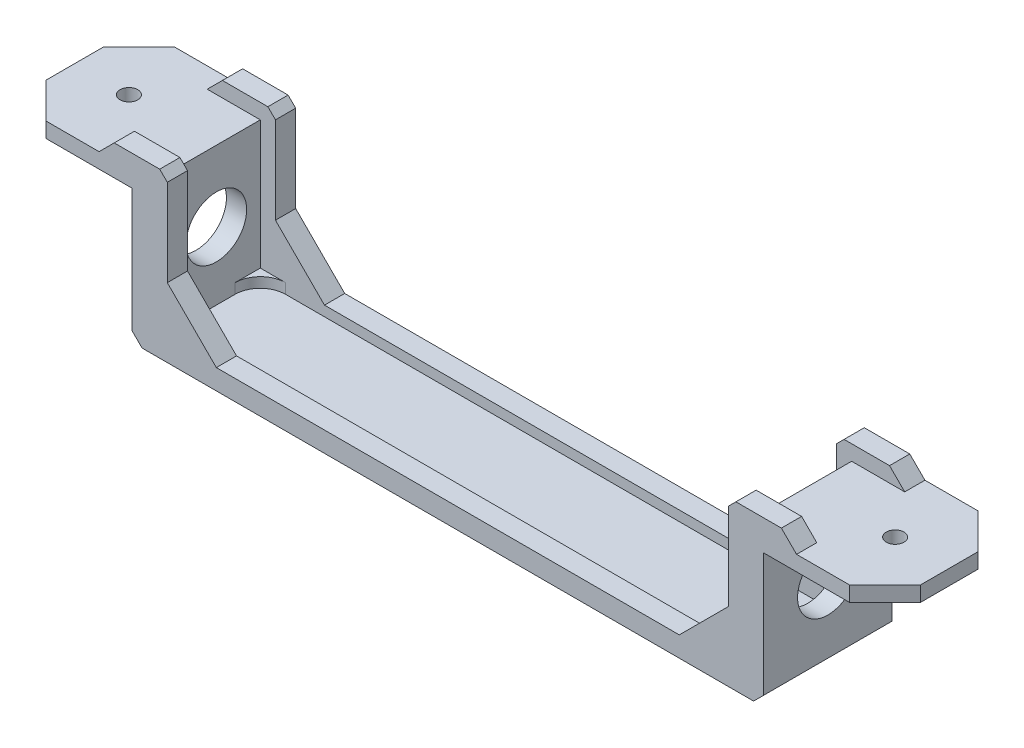
from build123d import *

# Parameters (mm, degrees)
SKETCH1_W           = 125
SKETCH1_H           = 25.4
BOSS_EXTRUDE1_DEPTH = 4
SKETCH2_W           = 117
SKETCH2_H           = 17.4
CUT_EXTRUDE1_DEPTH  = 2
FILLET1_R           = 5
SKETCH3_W           = 4
SKETCH3_H           = 25.4
BOSS_EXTRUDE2_DEPTH = 25.4
CHAMFER1_SIZE       = 2
SKETCH4_R           = 6
CUT_EXTRUDE3_DEPTH  = 135.4
SKETCH5_W           = 25.4
SKETCH5_H           = 3
BOSS_EXTRUDE3_DEPTH = 24
SKETCH6_W           = 25.4
SKETCH6_H           = 3
BOSS_EXTRUDE4_DEPTH = 24
BOSS_EXTRUDE5_DEPTH = 4
BOSS_EXTRUDE6_DEPTH = 4
SKETCH9_R           = 1.75
CUT_EXTRUDE4_DEPTH  = 4
CHAMFER2_SIZE       = 7
BOSS_EXTRUDE7_DEPTH = 4
BOSS_EXTRUDE8_DEPTH = 4
CHAMFER3_SIZE       = 1.5


with BuildPart() as part:
    # Sketch1 → Boss-Extrude1 (new body)
    with BuildSketch(Plane(origin=(0, 0, 0), x_dir=(1, 0, 0), z_dir=(0, 1, 0))):
        Rectangle(SKETCH1_W, SKETCH1_H)
    extrude(amount=BOSS_EXTRUDE1_DEPTH)

    # Sketch2 → Cut-Extrude1 (cut)
    with BuildSketch(Plane(origin=(0, 4, 0), x_dir=(1, 0, 0), z_dir=(0, 1, 0))):
        Rectangle(SKETCH2_W, SKETCH2_H)
    extrude(amount=-CUT_EXTRUDE1_DEPTH, mode=Mode.SUBTRACT)

    # Fillet1
    fillet1_edges = [part.edges().sort_by_distance(p)[0] for p in [
        (58.5, 3, -8.7),
        (58.5, 3, 8.7),
        (-58.5, 3, 8.7),
        (-58.5, 3, -8.7),
    ]]
    fillet(fillet1_edges, radius=FILLET1_R)

    # Sketch3 → Boss-Extrude2 (add)
    with BuildSketch(Plane(origin=(0, 4, 0), x_dir=(1, 0, 0), z_dir=(0, 1, 0))):
        with Locations((60.5, 0)):
            Rectangle(SKETCH3_W, SKETCH3_H)
        with Locations((-60.5, 0)):
            Rectangle(SKETCH3_W, SKETCH3_H)
    extrude(amount=BOSS_EXTRUDE2_DEPTH)

    # Chamfer1
    chamfer1_edges = [part.edges().sort_by_distance(p)[0] for p in [
        (-62.5, 0, 0),
        (62.5, 0, 0),
    ]]
    chamfer(chamfer1_edges, length=CHAMFER1_SIZE)

    # Sketch4 → Cut-Extrude3 (cut)
    with BuildSketch(Plane(origin=(62.5, 0, 0), x_dir=(0, 0, -1), z_dir=(1, 0, 0))):
        with Locations((0, 15.4)):
            Circle(SKETCH4_R)
    extrude(amount=-CUT_EXTRUDE3_DEPTH, mode=Mode.SUBTRACT)

    # Sketch5 → Boss-Extrude3 (add)
    with BuildSketch(Plane.ZY.offset(62.5)):
        with Locations((0, 27.9)):
            Rectangle(SKETCH5_W, SKETCH5_H)
    extrude(amount=BOSS_EXTRUDE3_DEPTH)

    # Sketch6 → Boss-Extrude4 (add)
    with BuildSketch(Plane(origin=(62.5, 0, 0), x_dir=(0, 0, -1), z_dir=(1, 0, 0))):
        with Locations((0, 27.9)):
            Rectangle(SKETCH6_W, SKETCH6_H)
    extrude(amount=BOSS_EXTRUDE4_DEPTH)

    # Sketch7 → Boss-Extrude5 (add)
    with BuildSketch(Plane.XY.offset(12.7)):
        Polygon((-58.5, 16.7), (-45.8, 4), (-58.5, 4), align=None)
        Polygon((58.5, 16.7), (45.8, 4), (58.5, 4), align=None)
    extrude(amount=-BOSS_EXTRUDE5_DEPTH)

    # Sketch8 → Boss-Extrude6 (add)
    with BuildSketch(Plane(origin=(0, 0, -12.7), x_dir=(-1, 0, 0), z_dir=(0, 0, -1))):
        Polygon((-58.5, 16.7), (-45.8, 4), (-58.5, 4), align=None)
        Polygon((58.5, 16.7), (45.8, 4), (58.5, 4), align=None)
    extrude(amount=-BOSS_EXTRUDE6_DEPTH)

    # Sketch9 → Cut-Extrude4 (cut)
    with BuildSketch(Plane(origin=(0, 29.4, 0), x_dir=(1, 0, 0), z_dir=(0, 1, 0))):
        with Locations(Location((75.8, 0, 0), (0, 0, 270))):
            Circle(SKETCH9_R)
        with Locations(Location((-75.8, 0, 0), (0, 0, 270))):
            Circle(SKETCH9_R)
    extrude(amount=-CUT_EXTRUDE4_DEPTH, mode=Mode.SUBTRACT)

    # Chamfer2
    chamfer2_edges = [part.edges().sort_by_distance(p)[0] for p in [
        (-86.5, 27.9, -12.7),
        (-86.5, 27.9, 12.7),
        (86.5, 27.9, 12.7),
        (86.5, 27.9, -12.7),
    ]]
    chamfer(chamfer2_edges, length=CHAMFER2_SIZE)

    # Sketch10 → Boss-Extrude7 (add)
    with BuildSketch(Plane(origin=(0, 0, -12.7), x_dir=(-1, 0, 0), z_dir=(0, 0, -1))):
        Polygon((-69, 29.4), (-66, 32.4), (-55.5, 32.4), (-55.5, 13.7), (-58.5, 16.7), (-58.5, 29.4), align=None)
        Polygon((69, 29.4), (66, 32.4), (55.5, 32.4), (55.5, 13.7), (58.5, 16.7), (58.5, 29.4), align=None)
    extrude(amount=-BOSS_EXTRUDE7_DEPTH)

    # Sketch11 → Boss-Extrude8 (add)
    with BuildSketch(Plane.XY.offset(12.7)):
        Polygon((69, 29.4), (66, 32.4), (55.5, 32.4), (55.5, 13.7), (58.5, 16.7), (58.5, 29.4), align=None)
        Polygon((-69, 29.4), (-66, 32.4), (-55.5, 32.4), (-55.5, 13.7), (-58.5, 16.7), (-58.5, 29.4), align=None)
    extrude(amount=-BOSS_EXTRUDE8_DEPTH)

    # Chamfer3
    chamfer3_edges = [part.edges().sort_by_distance(p)[0] for p in [
        (55.5, 32.4, -10.7),
        (-55.5, 32.4, -10.7),
        (55.5, 32.4, 10.7),
        (-55.5, 32.4, 10.7),
    ]]
    chamfer(chamfer3_edges, length=CHAMFER3_SIZE)


solid = part.part
